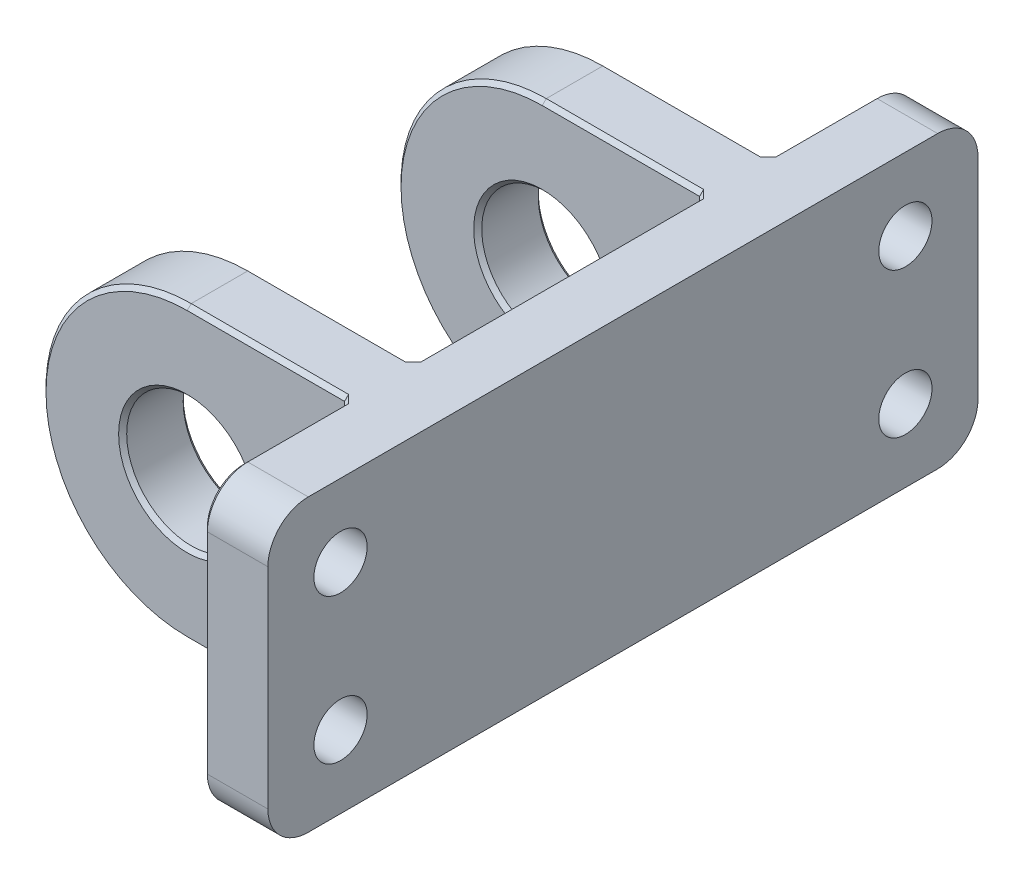
from build123d import *

# Parameters (mm, degrees)
SKETCH1_R                                           = 8
BOSS_EXTRUDE1_DEPTH                                 = 8
SKETCH3_W                                           = 44
SKETCH3_H                                           = 36
BOSS_EXTRUDE2_DEPTH                                 = 8
CSK_FOR_M6_COUNTERSUNK_FLAT_HEAD_SCREW1_D           = 6.6
CSK_FOR_M6_COUNTERSUNK_FLAT_HEAD_SCREW1_DEPTH       = 12
CSK_FOR_M6_COUNTERSUNK_FLAT_HEAD_SCREW1_CSINK_D     = 12.6
CSK_FOR_M6_COUNTERSUNK_FLAT_HEAD_SCREW1_CSINK_ANGLE = 90
CSK_FOR_M6_COUNTERSUNK_FLAT_HEAD_SCREW1_TIP         = 1.982840043
FILLET1_R                                           = 5
CHAMFER1_SIZE                                       = 0.5


with BuildPart() as part:
    # Sketch1 → Boss-Extrude1 (new body)
    with BuildSketch(Plane.XY):
        with BuildLine():
            Line((20, -18), (20, 18))
            Line((20, 18), (0, 18))
            ThreePointArc((0, 18), (-18, 0), (0, -18))
            Line((0, -18), (20, -18))
        make_face()
        Circle(SKETCH1_R, mode=Mode.SUBTRACT)
    extrude(amount=BOSS_EXTRUDE1_DEPTH)

    # Sketch3 → Boss-Extrude2 (add)
    with BuildSketch(Plane(origin=(20, 0, 0), x_dir=(0, 0, -1), z_dir=(1, 0, 0))):
        with Locations((-4, 0)):
            Rectangle(SKETCH3_W, SKETCH3_H)
    extrude(amount=BOSS_EXTRUDE2_DEPTH)

    # CSK for M6 Countersunk Flat Head Screw1
    with Locations(Plane.ZY.offset(-20)):
        with Locations((-9, 9), (-9, -9)):
            CounterSinkHole(CSK_FOR_M6_COUNTERSUNK_FLAT_HEAD_SCREW1_D / 2, CSK_FOR_M6_COUNTERSUNK_FLAT_HEAD_SCREW1_CSINK_D / 2, depth=CSK_FOR_M6_COUNTERSUNK_FLAT_HEAD_SCREW1_DEPTH, counter_sink_angle=CSK_FOR_M6_COUNTERSUNK_FLAT_HEAD_SCREW1_CSINK_ANGLE)
            with Locations((0, 0, -(CSK_FOR_M6_COUNTERSUNK_FLAT_HEAD_SCREW1_DEPTH + CSK_FOR_M6_COUNTERSUNK_FLAT_HEAD_SCREW1_TIP / 2))):  # 118° drill point
                Cone(0, CSK_FOR_M6_COUNTERSUNK_FLAT_HEAD_SCREW1_D / 2, CSK_FOR_M6_COUNTERSUNK_FLAT_HEAD_SCREW1_TIP, mode=Mode.SUBTRACT)

    # Fillet1
    fillet1_edges = [part.edges().sort_by_distance(p)[0] for p in [
        (24, -18, -18),
        (24, 18, -18),
    ]]
    fillet(fillet1_edges, radius=FILLET1_R)

    # Mirror1: part across plane


with BuildPart() as part_1:
    add(part.part)
    add(part.part.mirror(Plane(origin=(28, -18, 26), x_dir=(1, 0, 0), z_dir=(0, 0, -1))))

    # Chamfer1
    chamfer1_edges = [part_1.edges().sort_by_distance(p)[0] for p in [
        (-8, 0, 0),
        (-8, 0, 8),
        (20, 0, 8),
        (10, 18, 8),
        (20, 18, 26),
        (20, -18, 26),
        (20, -18, -6.5),
        (20, 0, -18),
        (20, 18, -6.5),
        (20, 16.535533906, -16.535533906),
        (-18, 0, 8),
        (10, 18, 0),
        (20, -16.535533906, -16.535533906),
        (20, 0, 0),
        (10, -18, 0),
        (-18, 0, 0),
        (-8, 0, 44),
        (-18, 0, 52),
        (10, -18, 52),
        (20, 0, 52),
        (10, 18, 52),
        (-18, 0, 44),
        (10, -18, 44),
        (10, 18, 44),
        (-8, 0, 52),
        (20, 0, 70),
        (20, 18, 58.5),
        (20, -18, 58.5),
        (20, 0, 44),
        (20, -16.535533906, 68.535533906),
        (20, 16.535533906, 68.535533906),
        (10, -18, 8),
    ]]
    chamfer(chamfer1_edges, length=CHAMFER1_SIZE)


solid = part_1.part
